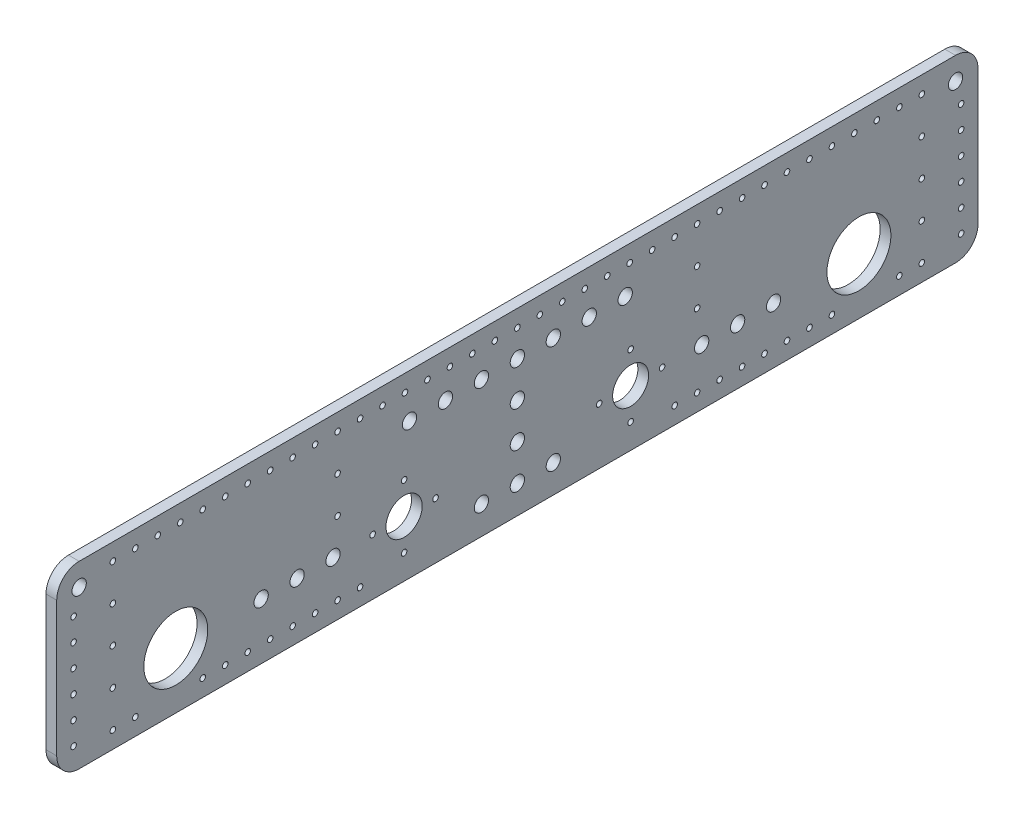
from build123d import *

# Parameters (mm, degrees)
SKETCH2_R           = 14.225
SKETCH2_R_2         = 3.18
SKETCH2_R_3         = 1.25
SKETCH2_R_4         = 8
SKETCH2_R_5         = 8.068284678
BOSS_EXTRUDE1_DEPTH = 4.7625


with BuildPart() as part:
    # Sketch2 → Boss-Extrude1 (new body)
    with BuildSketch(Plane(origin=(0, 0, 0), x_dir=(0, 0, -1), z_dir=(1, 0, 0))):
        with BuildLine():
            Line((-23.472321429, 28.668303571), (-23.472321429, -31.331696429))
            ThreePointArc((-23.472321429, -31.331696429), (-20.54338924, -38.40276424), (-13.472321429, -41.331696429))
            Line((-13.472321429, -41.331696429), (376.527678571, -41.331696429))
            ThreePointArc((376.527678571, -41.331696429), (383.598746383, -38.40276424), (386.527678571, -31.331696429))
            Line((386.527678571, -31.331696429), (386.527678571, 28.668303571))
            ThreePointArc((386.527678571, 28.668303571), (383.598746383, 35.739371383), (376.527678571, 38.668303571))
            Line((376.527678571, 38.668303571), (-13.472321429, 38.668303571))
            ThreePointArc((-13.472321429, 38.668303571), (-20.54338924, 35.739371383), (-23.472321429, 28.668303571))
        make_face()
        with Locations(Location((29.527678571, -16.331696429, 0), (0, 0, 180))):
            Circle(SKETCH2_R, mode=Mode.SUBTRACT)
        with Locations(Location((333.527678571, -16.331696429, 0), (0, 0, 180))):
            Circle(SKETCH2_R, mode=Mode.SUBTRACT)
        with Locations(Location((181.527678571, -28.771696429, 0), (0, 0, 180))):
            Circle(SKETCH2_R_2, mode=Mode.SUBTRACT)
        with Locations(Location((197.527678571, -28.771696429, 0), (0, 0, 180))):
            Circle(SKETCH2_R_2, mode=Mode.SUBTRACT)
        with Locations(Location((197.527678571, 19.228303571, 0), (0, 0, 180))):
            Circle(SKETCH2_R_2, mode=Mode.SUBTRACT)
        with Locations(Location((181.527678571, -12.771696429, 0), (0, 0, 180))):
            Circle(SKETCH2_R_2, mode=Mode.SUBTRACT)
        with Locations(Location((181.527678571, 3.228303571, 0), (0, 0, 180))):
            Circle(SKETCH2_R_2, mode=Mode.SUBTRACT)
        with Locations(Location((181.527678571, 19.228303571, 0), (0, 0, 180))):
            Circle(SKETCH2_R_2, mode=Mode.SUBTRACT)
        with Locations(Location((165.527678571, -28.771696429, 0), (0, 0, 180))):
            Circle(SKETCH2_R_2, mode=Mode.SUBTRACT)
        with Locations(Location((165.527678571, 19.228303571, 0), (0, 0, 180))):
            Circle(SKETCH2_R_2, mode=Mode.SUBTRACT)
        with Locations(Location((83.502678571, -16.331696429, 0), (0, 0, 180))):
            Circle(SKETCH2_R_2, mode=Mode.SUBTRACT)
        with Locations(Location((279.552678571, -16.331696429, 0), (0, 0, 180))):
            Circle(SKETCH2_R_2, mode=Mode.SUBTRACT)
        with Locations(Location((1.527678571, 31.168303571, 0), (0, 0, 180))):
            Circle(SKETCH2_R_3, mode=Mode.SUBTRACT)
        with Locations(Location((11.527678571, 31.168303571, 0), (0, 0, 180))):
            Circle(SKETCH2_R_3, mode=Mode.SUBTRACT)
        with Locations(Location((21.527678571, 31.168303571, 0), (0, 0, 180))):
            Circle(SKETCH2_R_3, mode=Mode.SUBTRACT)
        with Locations(Location((31.527678571, 31.168303571, 0), (0, 0, 180))):
            Circle(SKETCH2_R_3, mode=Mode.SUBTRACT)
        with Locations(Location((41.527678571, 31.168303571, 0), (0, 0, 180))):
            Circle(SKETCH2_R_3, mode=Mode.SUBTRACT)
        with Locations(Location((51.527678571, 31.168303571, 0), (0, 0, 180))):
            Circle(SKETCH2_R_3, mode=Mode.SUBTRACT)
        with Locations(Location((61.527678571, 31.168303571, 0), (0, 0, 180))):
            Circle(SKETCH2_R_3, mode=Mode.SUBTRACT)
        with Locations(Location((71.527678571, 31.168303571, 0), (0, 0, 180))):
            Circle(SKETCH2_R_3, mode=Mode.SUBTRACT)
        with Locations(Location((81.527678571, 31.168303571, 0), (0, 0, 180))):
            Circle(SKETCH2_R_3, mode=Mode.SUBTRACT)
        with Locations(Location((91.527678571, 31.168303571, 0), (0, 0, 180))):
            Circle(SKETCH2_R_3, mode=Mode.SUBTRACT)
        with Locations(Location((101.527678571, 31.168303571, 0), (0, 0, 180))):
            Circle(SKETCH2_R_3, mode=Mode.SUBTRACT)
        with Locations(Location((111.527678571, 31.168303571, 0), (0, 0, 180))):
            Circle(SKETCH2_R_3, mode=Mode.SUBTRACT)
        with Locations(Location((121.527678571, 31.168303571, 0), (0, 0, 180))):
            Circle(SKETCH2_R_3, mode=Mode.SUBTRACT)
        with Locations(Location((131.527678571, 31.168303571, 0), (0, 0, 180))):
            Circle(SKETCH2_R_3, mode=Mode.SUBTRACT)
        with Locations(Location((141.527678571, 31.168303571, 0), (0, 0, 180))):
            Circle(SKETCH2_R_3, mode=Mode.SUBTRACT)
        with Locations(Location((151.527678571, 31.168303571, 0), (0, 0, 180))):
            Circle(SKETCH2_R_3, mode=Mode.SUBTRACT)
        with Locations(Location((161.527678571, 31.168303571, 0), (0, 0, 180))):
            Circle(SKETCH2_R_3, mode=Mode.SUBTRACT)
        with Locations(Location((171.527678571, 31.168303571, 0), (0, 0, 180))):
            Circle(SKETCH2_R_3, mode=Mode.SUBTRACT)
        with Locations(Location((181.527678571, 31.168303571, 0), (0, 0, 180))):
            Circle(SKETCH2_R_3, mode=Mode.SUBTRACT)
        with Locations(Location((191.527678571, 31.168303571, 0), (0, 0, 180))):
            Circle(SKETCH2_R_3, mode=Mode.SUBTRACT)
        with Locations(Location((201.527678571, 31.168303571, 0), (0, 0, 180))):
            Circle(SKETCH2_R_3, mode=Mode.SUBTRACT)
        with Locations(Location((211.527678571, 31.168303571, 0), (0, 0, 180))):
            Circle(SKETCH2_R_3, mode=Mode.SUBTRACT)
        with Locations(Location((221.527678571, 31.168303571, 0), (0, 0, 180))):
            Circle(SKETCH2_R_3, mode=Mode.SUBTRACT)
        with Locations(Location((231.527678571, 31.168303571, 0), (0, 0, 180))):
            Circle(SKETCH2_R_3, mode=Mode.SUBTRACT)
        with Locations(Location((241.527678571, 31.168303571, 0), (0, 0, 180))):
            Circle(SKETCH2_R_3, mode=Mode.SUBTRACT)
        with Locations(Location((251.527678571, 31.168303571, 0), (0, 0, 180))):
            Circle(SKETCH2_R_3, mode=Mode.SUBTRACT)
        with Locations(Location((261.527678571, 31.168303571, 0), (0, 0, 180))):
            Circle(SKETCH2_R_3, mode=Mode.SUBTRACT)
        with Locations(Location((271.527678571, 31.168303571, 0), (0, 0, 180))):
            Circle(SKETCH2_R_3, mode=Mode.SUBTRACT)
        with Locations(Location((281.527678571, 31.168303571, 0), (0, 0, 180))):
            Circle(SKETCH2_R_3, mode=Mode.SUBTRACT)
        with Locations(Location((291.527678571, 31.168303571, 0), (0, 0, 180))):
            Circle(SKETCH2_R_3, mode=Mode.SUBTRACT)
        with Locations(Location((301.527678571, 31.168303571, 0), (0, 0, 180))):
            Circle(SKETCH2_R_3, mode=Mode.SUBTRACT)
        with Locations(Location((311.527678571, 31.168303571, 0), (0, 0, 180))):
            Circle(SKETCH2_R_3, mode=Mode.SUBTRACT)
        with Locations(Location((321.527678571, 31.168303571, 0), (0, 0, 180))):
            Circle(SKETCH2_R_3, mode=Mode.SUBTRACT)
        with Locations(Location((331.527678571, 31.168303571, 0), (0, 0, 180))):
            Circle(SKETCH2_R_3, mode=Mode.SUBTRACT)
        with Locations(Location((341.527678571, 31.168303571, 0), (0, 0, 180))):
            Circle(SKETCH2_R_3, mode=Mode.SUBTRACT)
        with Locations(Location((351.527678571, 31.168303571, 0), (0, 0, 180))):
            Circle(SKETCH2_R_3, mode=Mode.SUBTRACT)
        with Locations(Location((361.527678571, 31.168303571, 0), (0, 0, 180))):
            Circle(SKETCH2_R_3, mode=Mode.SUBTRACT)
        with Locations(Location((1.527678571, -33.831696429, 0), (0, 0, 180))):
            Circle(SKETCH2_R_3, mode=Mode.SUBTRACT)
        with Locations(Location((11.527678571, -33.831696429, 0), (0, 0, 180))):
            Circle(SKETCH2_R_3, mode=Mode.SUBTRACT)
        with Locations(Location((41.527678571, -33.831696429, 0), (0, 0, 180))):
            Circle(SKETCH2_R_3, mode=Mode.SUBTRACT)
        with Locations(Location((51.527678571, -33.831696429, 0), (0, 0, 180))):
            Circle(SKETCH2_R_3, mode=Mode.SUBTRACT)
        with Locations(Location((61.527678571, -33.831696429, 0), (0, 0, 180))):
            Circle(SKETCH2_R_3, mode=Mode.SUBTRACT)
        with Locations(Location((71.527678571, -33.831696429, 0), (0, 0, 180))):
            Circle(SKETCH2_R_3, mode=Mode.SUBTRACT)
        with Locations(Location((81.527678571, -33.831696429, 0), (0, 0, 180))):
            Circle(SKETCH2_R_3, mode=Mode.SUBTRACT)
        with Locations(Location((91.527678571, -33.831696429, 0), (0, 0, 180))):
            Circle(SKETCH2_R_3, mode=Mode.SUBTRACT)
        with Locations(Location((101.527678571, -33.831696429, 0), (0, 0, 180))):
            Circle(SKETCH2_R_3, mode=Mode.SUBTRACT)
        with Locations(Location((111.527678571, -33.831696429, 0), (0, 0, 180))):
            Circle(SKETCH2_R_3, mode=Mode.SUBTRACT)
        with Locations(Location((251.527678571, -33.831696429, 0), (0, 0, 180))):
            Circle(SKETCH2_R_3, mode=Mode.SUBTRACT)
        with Locations(Location((261.527678571, -33.831696429, 0), (0, 0, 180))):
            Circle(SKETCH2_R_3, mode=Mode.SUBTRACT)
        with Locations(Location((271.527678571, -33.831696429, 0), (0, 0, 180))):
            Circle(SKETCH2_R_3, mode=Mode.SUBTRACT)
        with Locations(Location((281.527678571, -33.831696429, 0), (0, 0, 180))):
            Circle(SKETCH2_R_3, mode=Mode.SUBTRACT)
        with Locations(Location((291.527678571, -33.831696429, 0), (0, 0, 180))):
            Circle(SKETCH2_R_3, mode=Mode.SUBTRACT)
        with Locations(Location((301.527678571, -33.831696429, 0), (0, 0, 180))):
            Circle(SKETCH2_R_3, mode=Mode.SUBTRACT)
        with Locations(Location((311.527678571, -33.831696429, 0), (0, 0, 180))):
            Circle(SKETCH2_R_3, mode=Mode.SUBTRACT)
        with Locations(Location((321.527678571, -33.831696429, 0), (0, 0, 180))):
            Circle(SKETCH2_R_3, mode=Mode.SUBTRACT)
        with Locations(Location((351.527678571, -33.831696429, 0), (0, 0, 180))):
            Circle(SKETCH2_R_3, mode=Mode.SUBTRACT)
        with Locations(Location((361.527678571, -33.831696429, 0), (0, 0, 180))):
            Circle(SKETCH2_R_3, mode=Mode.SUBTRACT)
        with Locations(Location((-13.472321429, 28.668303571, 0), (0, 0, 180))):
            Circle(SKETCH2_R_2, mode=Mode.SUBTRACT)
        with Locations(Location((376.527678571, 28.668303571, 0), (0, 0, 180))):
            Circle(SKETCH2_R_2, mode=Mode.SUBTRACT)
        with Locations(Location((295.552678571, -16.331696429, 0), (0, 0, 180))):
            Circle(SKETCH2_R_2, mode=Mode.SUBTRACT)
        with Locations(Location((67.502678571, -16.331696429, 0), (0, 0, 180))):
            Circle(SKETCH2_R_2, mode=Mode.SUBTRACT)
        with Locations(Location((263.552678571, -16.331696429, 0), (0, 0, 180))):
            Circle(SKETCH2_R_2, mode=Mode.SUBTRACT)
        with Locations(Location((131.127678571, -30.331696429, 0), (0, 0, 180))):
            Circle(SKETCH2_R_3, mode=Mode.SUBTRACT)
        with Locations(Location((145.127678571, -16.331696429, 0), (0, 0, 180))):
            Circle(SKETCH2_R_3, mode=Mode.SUBTRACT)
        with Locations(Location((131.127678571, -2.331696429, 0), (0, 0, 180))):
            Circle(SKETCH2_R_3, mode=Mode.SUBTRACT)
        with Locations(Location((117.127678571, -16.331696429, 0), (0, 0, 180))):
            Circle(SKETCH2_R_3, mode=Mode.SUBTRACT)
        with Locations(Location((231.927678571, -30.331696429, 0), (0, 0, 180))):
            Circle(SKETCH2_R_3, mode=Mode.SUBTRACT)
        with Locations(Location((217.927678571, -16.331696429, 0), (0, 0, 180))):
            Circle(SKETCH2_R_3, mode=Mode.SUBTRACT)
        with Locations(Location((231.927678571, -2.331696429, 0), (0, 0, 180))):
            Circle(SKETCH2_R_3, mode=Mode.SUBTRACT)
        with Locations(Location((245.927678571, -16.331696429, 0), (0, 0, 180))):
            Circle(SKETCH2_R_3, mode=Mode.SUBTRACT)
        with Locations(Location((231.927678571, -16.331696429, 0), (0, 0, 180))):
            Circle(SKETCH2_R_4, mode=Mode.SUBTRACT)
        with Locations(Location((131.127678571, -16.331696429, 0), (0, 0, 180))):
            Circle(SKETCH2_R_5, mode=Mode.SUBTRACT)
        with Locations(Location((-15.972321429, 18.668303571, 0), (0, 0, 180))):
            Circle(SKETCH2_R_3, mode=Mode.SUBTRACT)
        with Locations(Location((379.027678571, 18.668303571, 0), (0, 0, 180))):
            Circle(SKETCH2_R_3, mode=Mode.SUBTRACT)
        with Locations(Location((379.027678571, 8.668303571, 0), (0, 0, 180))):
            Circle(SKETCH2_R_3, mode=Mode.SUBTRACT)
        with Locations(Location((379.027678571, -1.331696429, 0), (0, 0, 180))):
            Circle(SKETCH2_R_3, mode=Mode.SUBTRACT)
        with Locations(Location((379.027678571, -11.331696429, 0), (0, 0, 180))):
            Circle(SKETCH2_R_3, mode=Mode.SUBTRACT)
        with Locations(Location((379.027678571, -21.331696429, 0), (0, 0, 180))):
            Circle(SKETCH2_R_3, mode=Mode.SUBTRACT)
        with Locations(Location((379.027678571, -31.331696429, 0), (0, 0, 180))):
            Circle(SKETCH2_R_3, mode=Mode.SUBTRACT)
        with Locations(Location((-15.972321429, 8.668303571, 0), (0, 0, 180))):
            Circle(SKETCH2_R_3, mode=Mode.SUBTRACT)
        with Locations(Location((-15.972321429, -1.331696429, 0), (0, 0, 180))):
            Circle(SKETCH2_R_3, mode=Mode.SUBTRACT)
        with Locations(Location((-15.972321429, -11.331696429, 0), (0, 0, 180))):
            Circle(SKETCH2_R_3, mode=Mode.SUBTRACT)
        with Locations(Location((-15.972321429, -21.331696429, 0), (0, 0, 180))):
            Circle(SKETCH2_R_3, mode=Mode.SUBTRACT)
        with Locations(Location((-15.972321429, -31.331696429, 0), (0, 0, 180))):
            Circle(SKETCH2_R_3, mode=Mode.SUBTRACT)
        with Locations(Location((101.527678571, -1.331696429, 0), (0, 0, 180))):
            Circle(SKETCH2_R_3, mode=Mode.SUBTRACT)
        with Locations(Location((101.527678571, 14.918303571, 0), (0, 0, 180))):
            Circle(SKETCH2_R_3, mode=Mode.SUBTRACT)
        with Locations(Location((361.527678571, -17.581696429, 0), (0, 0, 180))):
            Circle(SKETCH2_R_3, mode=Mode.SUBTRACT)
        with Locations(Location((361.527678571, -1.331696429, 0), (0, 0, 180))):
            Circle(SKETCH2_R_3, mode=Mode.SUBTRACT)
        with Locations(Location((361.527678571, 14.918303571, 0), (0, 0, 180))):
            Circle(SKETCH2_R_3, mode=Mode.SUBTRACT)
        with Locations(Location((1.527678571, -17.581696429, 0), (0, 0, 180))):
            Circle(SKETCH2_R_3, mode=Mode.SUBTRACT)
        with Locations(Location((1.527678571, -1.331696429, 0), (0, 0, 180))):
            Circle(SKETCH2_R_3, mode=Mode.SUBTRACT)
        with Locations(Location((1.527678571, 14.918303571, 0), (0, 0, 180))):
            Circle(SKETCH2_R_3, mode=Mode.SUBTRACT)
        with Locations(Location((99.502678571, -16.331696429, 0), (0, 0, 180))):
            Circle(SKETCH2_R_2, mode=Mode.SUBTRACT)
        with Locations(Location((261.527678571, -1.331696429, 0), (0, 0, 180))):
            Circle(SKETCH2_R_3, mode=Mode.SUBTRACT)
        with Locations(Location((261.527678571, 14.918303571, 0), (0, 0, 180))):
            Circle(SKETCH2_R_3, mode=Mode.SUBTRACT)
        with Locations(Location((149.527678571, 19.228303571, 0), (0, 0, 180))):
            Circle(SKETCH2_R_2, mode=Mode.SUBTRACT)
        with Locations(Location((133.527678571, 19.228303571, 0), (0, 0, 180))):
            Circle(SKETCH2_R_2, mode=Mode.SUBTRACT)
        with Locations(Location((213.527678571, 19.228303571, 0), (0, 0, 180))):
            Circle(SKETCH2_R_2, mode=Mode.SUBTRACT)
        with Locations(Location((229.527678571, 19.228303571, 0), (0, 0, 180))):
            Circle(SKETCH2_R_2, mode=Mode.SUBTRACT)
    extrude(amount=BOSS_EXTRUDE1_DEPTH)


solid = part.part
